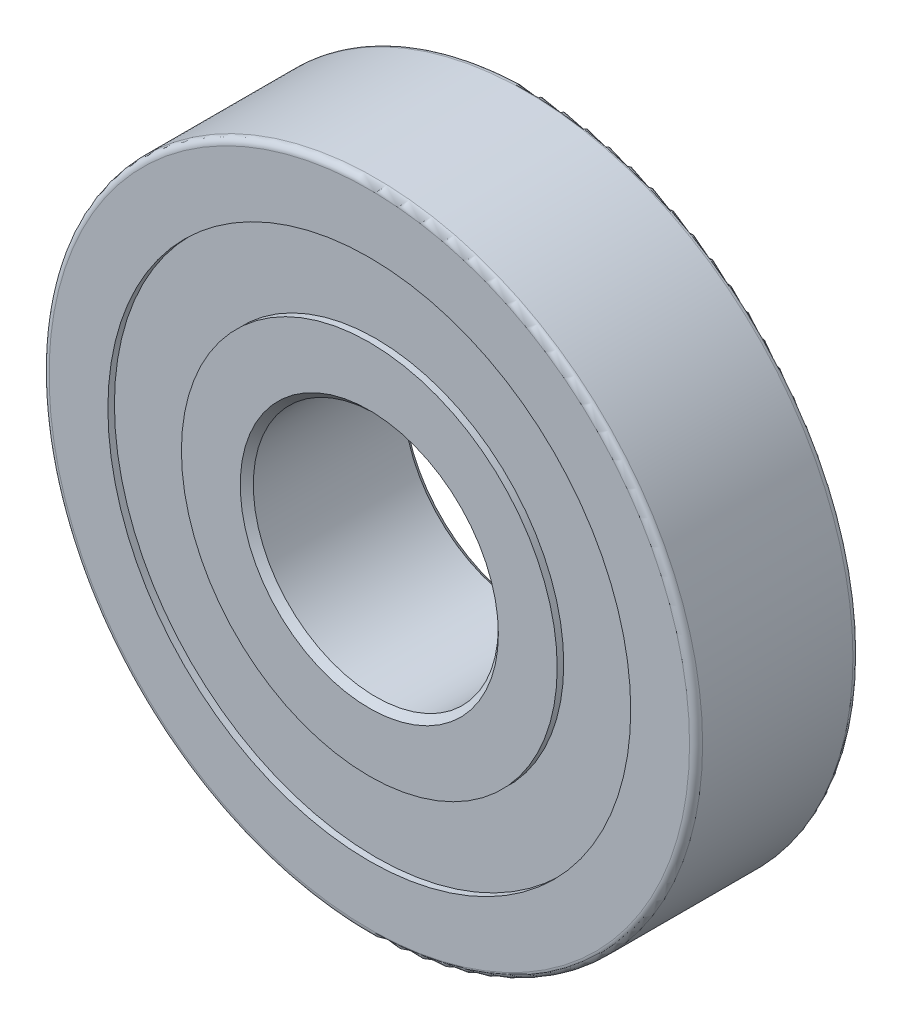
from build123d import *

# Parameters (mm, degrees)
SKETCH1_R             = 6.35
SKETCH1_R_2           = 5.08
BOSS_EXTRUDE1_DEPTH   = 1.5875
SKETCH1_R_3           = 3.65125
SKETCH1_R_4           = 2.38125
BOSS_EXTRUDE1_2_DEPTH = 1.5875
SKETCH2_R             = 5.08
SKETCH2_R_2           = 3.65125
BOSS_EXTRUDE2_DEPTH   = 1.4605
FILLET1_R             = 0.127
CHAMFER1_SIZE         = 0.127


with BuildPart() as part:
    # Sketch1 → Boss-Extrude1 (new, symmetric)
    with BuildSketch(Plane.XY):
        Circle(SKETCH1_R)
        Circle(SKETCH1_R_2, mode=Mode.SUBTRACT)
    extrude(amount=BOSS_EXTRUDE1_DEPTH, both=True)



with BuildPart() as body_2:
    # Sketch1 → Boss-Extrude1 2 (new, symmetric)
    with BuildSketch(Plane.XY):
        Circle(SKETCH1_R_3)
        Circle(SKETCH1_R_4, mode=Mode.SUBTRACT)
    extrude(amount=BOSS_EXTRUDE1_2_DEPTH, both=True)


with BuildPart() as part_1:
    add(part.part)

    add(body_2.part)  # Boss-Extrude2 merges body 2
    # Sketch2 → Boss-Extrude2 (add, symmetric)
    with BuildSketch(Plane.XY):
        Circle(SKETCH2_R)
        Circle(SKETCH2_R_2, mode=Mode.SUBTRACT)
    extrude(amount=BOSS_EXTRUDE2_DEPTH, both=True)

    # Fillet1
    fillet1_edges = [part_1.edges().sort_by_distance(p)[0] for p in [
        (-6.35, 0, -1.5875),
        (-6.35, 0, 1.5875),
    ]]
    fillet(fillet1_edges, radius=FILLET1_R)

    # Chamfer1
    chamfer1_edges = [part_1.edges().sort_by_distance(p)[0] for p in [
        (-2.38125, 0, 1.5875),
        (-2.38125, 0, -1.5875),
    ]]
    chamfer(chamfer1_edges, length=CHAMFER1_SIZE)


solid = part_1.part
